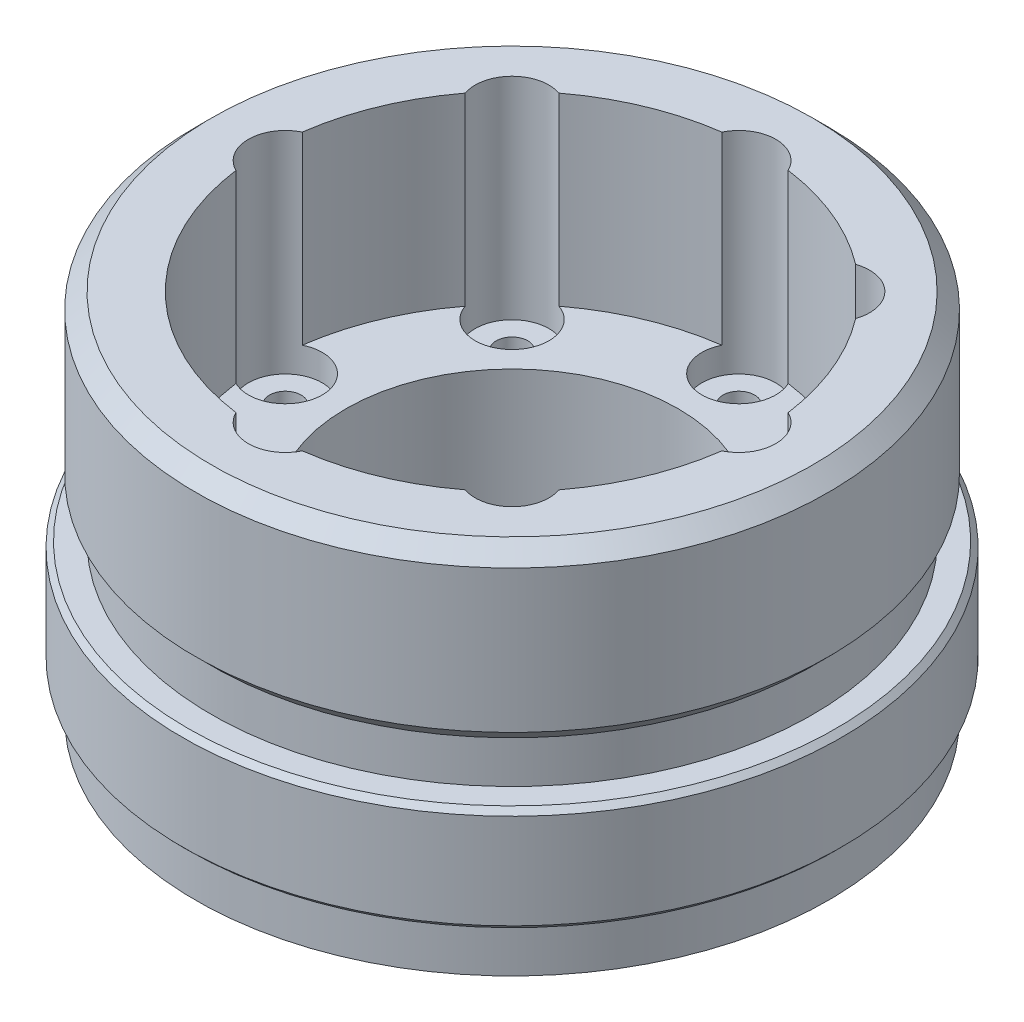
from build123d import *

# Parameters (mm, degrees)
PATTERN_CIRCULAR_1_COUNT = 8


with BuildPart() as part:
    # Эскиз1 → Повернуть1 (revolve)
    with BuildSketch(Plane.XY, mode=Mode.PRIVATE) as revolve_1_sk:
        Polygon((-42, 0), (-60, 0), (-60, 9), (-61.5, 9), (-62.5, 10), (-62.5, 28), (-61.5, 29), (-57, 29), (-57, 37), (-60, 40), (-60, 67), (-57, 70), (-46.5, 70), (-46.5, 35), (-31.5, 35), (-31.5, 10), (-42, 10), align=None)
    revolve(revolve_1_sk.sketch.rotate(Axis((0, 0, 0), (0, 1, 0)), 270), axis=Axis((0, 0, 0), (0, 1, 0)))

    # Эскиз5 → Вырез-Повернуть1 (revolve, cut)
    with BuildSketch(Plane.XY):
        Polygon((-43, 0), (-46, 0), (-46, 30), (-50, 30), (-50, 70), (-43, 70), align=None)
    cut_revolve_1 = revolve(axis=Axis((-43, 84.512066433, 0), (0, -1, 0)), mode=Mode.SUBTRACT)

    # Круговой массив1: Вырез-Повернуть1 ×8 about axis, 1 skipped
    pattern_circular_1_axis = Axis((0, 0, 0), (0, -1, 0))
    add([cut_revolve_1.rotate(pattern_circular_1_axis, i * 360 / PATTERN_CIRCULAR_1_COUNT) for i in range(1, PATTERN_CIRCULAR_1_COUNT) if i not in (7,)], mode=Mode.SUBTRACT)


solid = part.part
